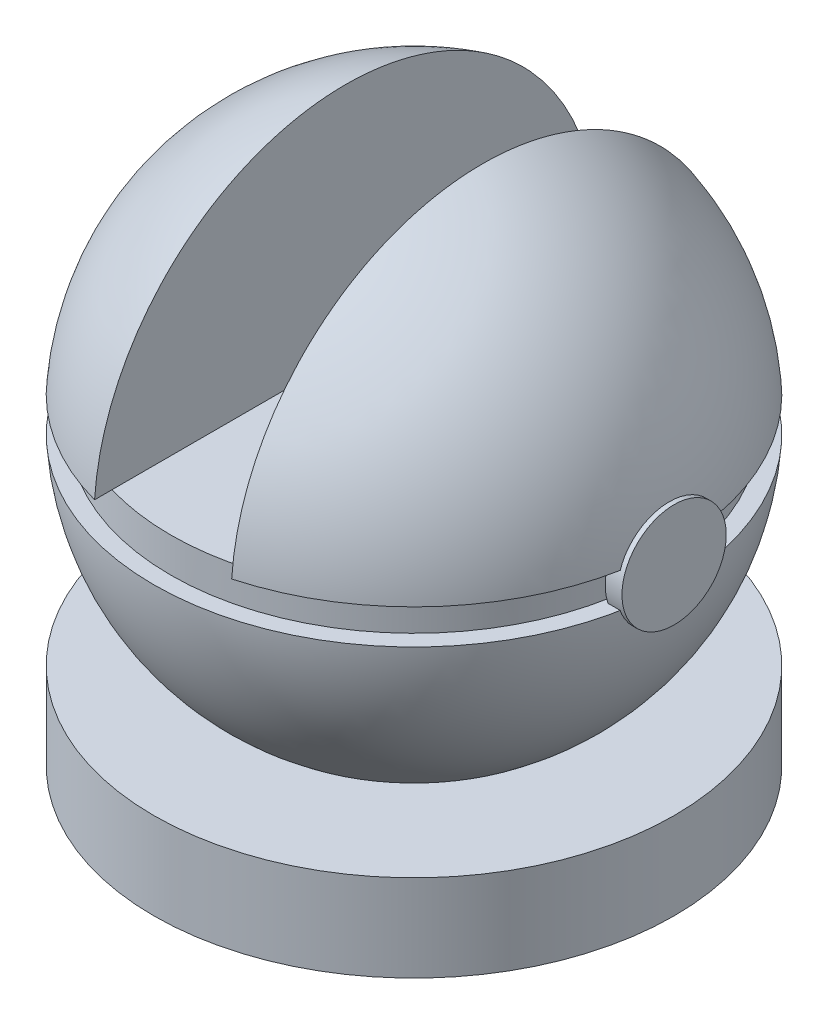
from build123d import *

# Parameters (mm, degrees)
SKETCH4_R                = 7.62
BOSS_EXTRUDE3_DEPTH      = 2.455239
CUT_EXTRUDE1_DEPTH       = 66.893298597
CUT_EXTRUDE1_DEPTH_BACK  = 66.893298597
SKETCH5_W                = 20.0406
SKETCH5_H                = 35.56
BOSS_EXTRUDE4_DEPTH      = 6.35
BOSS_EXTRUDE4_DEPTH_BACK = 6.35
SKETCH6_R                = 38.01523905


with BuildPart() as part:
    # Sketch1 → Revolve1 (revolve)
    with BuildSketch(Plane.XY, mode=Mode.PRIVATE) as revolve1_sk:
        with BuildLine():
            Line((0, 38.1), (0, -38.1))
            ThreePointArc((0, -38.1), (-26.027254946, -27.824305921), (-38.01523905, -2.54))
            Line((-38.01523905, -2.54), (-35.56, -2.54))
            Line((-35.56, -2.54), (-35.56, 2.54))
            Line((-35.56, 2.54), (-38.01523905, 2.54))
            ThreePointArc((-38.01523905, 2.54), (-26.027254946, 27.824305921), (0, 38.1))
        make_face()
    revolve(revolve1_sk.sketch.rotate(Axis((0, 38.1, 0), (0, -1, 0)), 270), axis=Axis((0, 38.1, 0), (0, -1, 0)))

    # Sketch5 → Cut-Extrude1 (cut, two sides: drawn at the far end of the back side and taken through both)
    with BuildSketch(Plane.XY.offset(-CUT_EXTRUDE1_DEPTH_BACK)):
        with Locations((0, 20.32)):
            Rectangle(SKETCH5_W, SKETCH5_H)
    extrude(amount=CUT_EXTRUDE1_DEPTH + CUT_EXTRUDE1_DEPTH_BACK, mode=Mode.SUBTRACT)


with BuildPart() as body_2:
    # Sketch4 → Boss-Extrude3 (new, through all)
    with BuildSketch(Plane(origin=(35.56, 0, 0), x_dir=(0, 0, -1), z_dir=(1, 0, 0))):
        Circle(SKETCH4_R)
    extrude(amount=BOSS_EXTRUDE3_DEPTH)


with BuildPart() as body_3:
    # Sketch6 → Boss-Extrude4 (new, two sides: drawn at the far end of the back side and taken through both)
    with BuildSketch(Plane(origin=(0, -38.1, 0), x_dir=(-1, 0, 0), z_dir=(0, -1, 0)).offset(-BOSS_EXTRUDE4_DEPTH_BACK)):
        with Locations(Location((0, 0, 0), (0, 0, 90))):
            Circle(SKETCH6_R)
    extrude(amount=BOSS_EXTRUDE4_DEPTH + BOSS_EXTRUDE4_DEPTH_BACK)


solid = Compound([part.part, body_2.part, body_3.part])
